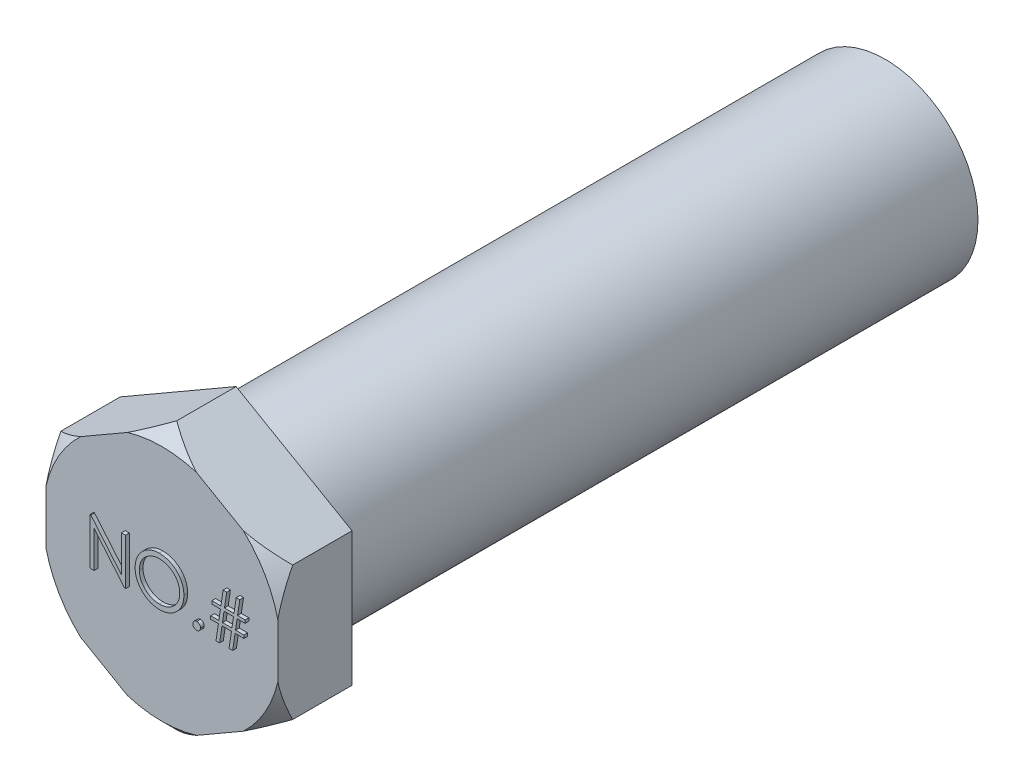
from build123d import *

# Parameters (mm, degrees)
SKETCH1_R           = 5
BOSS_EXTRUDE1_DEPTH = 35
BOSS_EXTRUDE2_DEPTH = 4
BOSS_EXTRUDE3_DEPTH = 0.2


with BuildPart() as part:
    # Sketch1 → Boss-Extrude1 (new body)
    with BuildSketch(Plane.XY):
        Circle(SKETCH1_R)
    extrude(amount=-BOSS_EXTRUDE1_DEPTH)

    # Sketch2 → Boss-Extrude2 (add)
    with BuildSketch(Plane.XY):
        Polygon((-6.25, -3.608439182), (0, -7.216878365), (6.25, -3.608439182), (6.25, 3.608439182), (0, 7.216878365), (-6.25, 3.608439182), align=None)
    extrude(amount=BOSS_EXTRUDE2_DEPTH)

    # Sketch3 → Cut-Revolve1 (revolve, cut)
    with BuildSketch(Plane(origin=(0, 0, 0), x_dir=(0, 0, -1), z_dir=(1, 0, 0))):
        Polygon((-3.2, 7.216878365), (-4, 7.216878365), (-4, 6.416878365), align=None)
    revolve(axis=Axis((0, 0, 0), (0, 0, 1)), mode=Mode.SUBTRACT)

    # Sketch4 → Boss-Extrude3 (add)
    # profile 1 of 4: a face of its own
    with BuildSketch(Plane.XY.offset(4)):
        Polygon((-3.679487179, -1), (-3.679487179, 1.5), (-3.632411859, 1.5), (-1.980769231, -0.467648237), (-1.980769231, 1.5), (-1.756410256, 1.5), (-1.756410256, -1), (-1.807491987, -1), (-3.455128205, 0.963141026), (-3.455128205, -1), align=None)
    # profile 2 of 4: a face of its own
    with BuildSketch(Plane.XY.offset(4)):
        with BuildLine():
            add(Edge.make_bspline(
                [(0.054487179, 1.564102564), (0.100778684, 1.562930079), (0.191699017, 1.560627221), (0.325323944, 1.54299929), (0.452891869, 1.512502583), (0.575441969, 1.471886167), (0.69150838, 1.417704463), (0.801964732, 1.352215071), (0.906548213, 1.274731886), (1.0038492, 1.185853867), (1.092889879, 1.0891514), (1.171336941, 0.985952893), (1.237081436, 0.87688232), (1.291071284, 0.762267441), (1.333427434, 0.642367464), (1.362655322, 0.516543176), (1.38132543, 0.385609826), (1.383508128, 0.296304923), (1.384615385, 0.251001603)],
                knots=[0, 0, 0, 0, 1.065120563, 2.091984664, 3.0946048, 4.079830382, 5.057816894, 6.036188127, 7.030412546, 8.04752943, 9.064399622, 10.05169764, 11.02544977, 11.989514704, 12.962713494, 13.945757189, 14.957906945, 16, 16, 16, 16], degree=3))
            add(Edge.make_bspline(
                [(1.384615385, 0.251001603), (1.38350829, 0.206031998), (1.381326078, 0.117391698), (1.362634094, -0.012710762), (1.333319094, -0.137775546), (1.291464618, -0.257593869), (1.237732134, -0.372292129), (1.171549869, -0.481568524), (1.093591861, -0.58545888), (1.004872682, -0.68282507), (0.908157652, -0.772108978), (0.804421747, -0.849908174), (0.695997947, -0.916853978), (0.581491012, -0.970270888), (0.462419558, -1.012965117), (0.337717898, -1.042074138), (0.20797036, -1.060850598), (0.119491071, -1.06300668), (0.074519231, -1.064102564)],
                knots=[0, 0, 0, 0, 1.043624062, 2.057103931, 3.04512605, 4.022047818, 4.998200453, 5.980619268, 6.982898556, 8.009068085, 9.034988726, 10.034168286, 11.015286542, 11.987931943, 12.962482838, 13.94673481, 14.956375938, 16, 16, 16, 16], degree=3))
            add(Edge.make_bspline(
                [(0.074519231, -1.064102564), (0.029216146, -1.062995859), (-0.060088294, -1.060814249), (-0.191186177, -1.042113246), (-0.317098851, -1.012869457), (-0.437466244, -0.971077003), (-0.55235548, -0.917064695), (-0.661991253, -0.851204425), (-0.765933501, -0.773056467), (-0.863320463, -0.684366056), (-0.952427033, -0.587814948), (-1.030112302, -0.484361908), (-1.095987382, -0.376036582), (-1.149818334, -0.262538351), (-1.192435805, -0.144415891), (-1.221510675, -0.020881265), (-1.24032207, 0.107361239), (-1.242489817, 0.194677595), (-1.243589744, 0.238982372)],
                knots=[0, 0, 0, 0, 1.053102029, 2.075944431, 3.073151272, 4.055350789, 5.033113405, 6.020478099, 7.024410459, 8.052272461, 9.079885166, 10.07527673, 11.055994387, 12.023226415, 12.992069828, 13.970394897, 14.97016774, 16, 16, 16, 16], degree=3))
            add(Edge.make_bspline(
                [(-1.243589744, 0.238982372), (-1.243207861, 0.268719993), (-1.242448914, 0.327820081), (-1.233311991, 0.415581938), (-1.220053633, 0.501932408), (-1.201052266, 0.586625942), (-1.176201076, 0.669455217), (-1.146878199, 0.750991476), (-1.111064024, 0.830408422), (-1.070577847, 0.908082273), (-1.025390841, 0.982802206), (-0.975479591, 1.053430479), (-0.922597185, 1.120559763), (-0.864623333, 1.18245048), (-0.803468729, 1.240903091), (-0.738141316, 1.295019318), (-0.669039713, 1.34528714), (-0.595866584, 1.390587384), (-0.520424959, 1.431558194), (-0.442655832, 1.466716659), (-0.363615424, 1.496892417), (-0.282933533, 1.52135015), (-0.20082441, 1.540658747), (-0.11710885, 1.553806856), (-0.031853545, 1.562967084), (0.025583111, 1.563722442), (0.054487179, 1.564102564)],
                knots=[0, 0, 0, 0, 1.037015668, 2.060948919, 3.074880161, 4.083647147, 5.086022904, 6.090072063, 7.104153813, 8.122640571, 9.144368836, 10.147691507, 11.138137339, 12.123020368, 13.103399296, 14.087645067, 15.080126199, 16.082011238, 17.087798457, 18.072939717, 19.057185487, 20.037253025, 21.01195951, 21.997135196, 22.992090687, 24, 24, 24, 24], degree=3))
        make_face()
        with BuildLine():
            add(Edge.make_bspline(
                [(0.065504808, 1.307692308), (0.041780069, 1.3074031), (-0.005442597, 1.306827451), (-0.075645837, 1.299244797), (-0.14492579, 1.288437733), (-0.213296763, 1.273022361), (-0.280472684, 1.252019466), (-0.347079713, 1.227847389), (-0.412510466, 1.198403753), (-0.476548936, 1.165137535), (-0.538631132, 1.128316878), (-0.597211633, 1.087622758), (-0.652442093, 1.044009505), (-0.704187284, 0.997375336), (-0.752295264, 0.947482763), (-0.797712908, 0.895088166), (-0.838619752, 0.838693958), (-0.87610945, 0.779829382), (-0.909657907, 0.718571109), (-0.939490303, 0.655564065), (-0.963893167, 0.590294289), (-0.983794864, 0.52346989), (-1.000294729, 0.455196705), (-1.010747532, 0.384956813), (-1.018413503, 0.313103161), (-1.01895625, 0.264544694), (-1.019230769, 0.239983974)],
                knots=[0, 0, 0, 0, 1.008559885, 2.007477868, 2.99961109, 3.989939068, 4.984837346, 5.991145699, 7.001802488, 8.033829008, 9.059044045, 10.069351652, 11.065060232, 12.050310815, 13.029377138, 14.011219647, 14.996725999, 15.989392538, 16.977580475, 17.965360261, 18.951710183, 19.937753436, 20.929683414, 21.935841486, 22.955955122, 24, 24, 24, 24], degree=3))
            add(Edge.make_bspline(
                [(-1.019230769, 0.239983974), (-1.018320154, 0.203868102), (-1.016528691, 0.132817009), (-1.000844712, 0.028696907), (-0.976686159, -0.071366155), (-0.941073754, -0.166824662), (-0.896537601, -0.25849915), (-0.841518394, -0.345576367), (-0.776333333, -0.428079849), (-0.702287956, -0.505433612), (-0.621343166, -0.576037758), (-0.535391216, -0.638011622), (-0.445352925, -0.690447514), (-0.350993494, -0.733165423), (-0.252816681, -0.767015236), (-0.150189859, -0.790214258), (-0.043796673, -0.805482441), (0.028725223, -0.806948695), (0.065504808, -0.807692308)],
                knots=[0, 0, 0, 0, 1.032063989, 2.030389145, 3.003944642, 3.970395727, 4.937377036, 5.913328081, 6.909231446, 7.93887556, 8.970685674, 9.976071282, 10.964166581, 11.944589148, 12.933237628, 13.927779006, 14.949070134, 16, 16, 16, 16], degree=3))
            add(Edge.make_bspline(
                [(0.065504808, -0.807692308), (0.09022588, -0.807352662), (0.139255192, -0.806679042), (0.212180565, -0.799894273), (0.283792145, -0.789014366), (0.353989488, -0.773349612), (0.422692924, -0.753744464), (0.490189212, -0.73045323), (0.55575942, -0.701395227), (0.620230732, -0.669289548), (0.681942334, -0.632689435), (0.740853428, -0.593376471), (0.795479128, -0.549827456), (0.847185608, -0.503886162), (0.8954911, -0.45462627), (0.940068946, -0.402111826), (0.98076904, -0.346011357), (1.018244502, -0.287236067), (1.051675404, -0.225810172), (1.080803332, -0.162574688), (1.105514843, -0.097685324), (1.125463775, -0.031048487), (1.141096248, 0.037209262), (1.151867619, 0.107179318), (1.159402218, 0.178721705), (1.15997013, 0.227110174), (1.16025641, 0.251502404)],
                knots=[0, 0, 0, 0, 1.047197238, 2.076906641, 3.100256066, 4.114471768, 5.12198147, 6.126382909, 7.136867548, 8.15857795, 9.17633901, 10.174870724, 11.156907918, 12.133735059, 13.104061851, 14.077631395, 15.04955518, 16.038496417, 17.029181396, 18.010275684, 18.986308667, 19.968651475, 20.955262928, 21.950658345, 22.966943676, 24, 24, 24, 24], degree=3))
            add(Edge.make_bspline(
                [(1.16025641, 0.251502404), (1.159969901, 0.275727764), (1.159401557, 0.323783228), (1.151871218, 0.39482667), (1.141084868, 0.46429325), (1.125540076, 0.531910252), (1.105504252, 0.597694913), (1.080799016, 0.661585447), (1.051666659, 0.723819872), (1.018232213, 0.78424437), (0.980649482, 0.842226325), (0.939582166, 0.89765662), (0.894321203, 0.949494292), (0.846159756, 0.999019074), (0.793894838, 1.045174709), (0.7377632, 1.08797651), (0.678446287, 1.12845742), (0.615641119, 1.164975678), (0.550824009, 1.19870013), (0.484314039, 1.227593704), (0.416864682, 1.252145218), (0.348647459, 1.273085907), (0.279088189, 1.288377357), (0.208656883, 1.299254536), (0.137450984, 1.306824811), (0.08956297, 1.307402225), (0.065504808, 1.307692308)],
                knots=[0, 0, 0, 0, 1.02996197, 2.043119294, 3.035359645, 4.018872909, 4.991431989, 5.957985074, 6.929999688, 7.912076566, 8.892894881, 9.867085534, 10.843653904, 11.817741046, 12.803660682, 13.806313499, 14.818574707, 15.856120519, 16.894564902, 17.924820532, 18.937903209, 19.946497019, 20.957711757, 21.963978472, 22.977135795, 24, 24, 24, 24], degree=3))
        make_face(mode=Mode.SUBTRACT)
    # profile 3 of 4: a face of its own
    with BuildSketch(Plane.XY.offset(4)):
        with BuildLine():
            add(Edge.make_bspline(
                [(2.073717949, -0.615384615), (2.087639529, -0.616211877), (2.114931159, -0.617833628), (2.154387679, -0.628959823), (2.190098151, -0.648716009), (2.221906897, -0.675046565), (2.248125809, -0.706972039), (2.26858606, -0.742397688), (2.279615335, -0.78218454), (2.281225272, -0.809634308), (2.282051282, -0.823717949)],
                knots=[0, 0, 0, 0, 1.020151414, 1.999887582, 2.974338812, 3.990962822, 5.007586832, 5.987933904, 6.967670073, 8, 8, 8, 8], degree=3))
            add(Edge.make_bspline(
                [(2.282051282, -0.823717949), (2.281197282, -0.837463184), (2.279513205, -0.864568587), (2.268611342, -0.904055346), (2.247969878, -0.939503135), (2.22208774, -0.971861805), (2.190090287, -0.998248141), (2.154303254, -1.017836244), (2.115023784, -1.029759087), (2.087654982, -1.031277871), (2.073717949, -1.032051282)],
                knots=[0, 0, 0, 0, 1.009421747, 1.99056486, 2.972319754, 3.999869655, 5.017953583, 5.993804169, 6.978383603, 8, 8, 8, 8], degree=3))
            add(Edge.make_bspline(
                [(2.073717949, -1.032051282), (2.059770873, -1.031305855), (2.032542529, -1.029850588), (1.993409676, -1.01759144), (1.957404698, -0.998431826), (1.925413475, -0.971812605), (1.899314567, -0.939669645), (1.879582151, -0.903811219), (1.867732044, -0.864681621), (1.866173564, -0.837485448), (1.865384615, -0.823717949)],
                knots=[0, 0, 0, 0, 1.022052826, 1.995314843, 2.982371812, 4.00089066, 5.028879526, 6.005146991, 6.990147033, 8, 8, 8, 8], degree=3))
            add(Edge.make_bspline(
                [(1.865384615, -0.823717949), (1.866143258, -0.809611249), (1.867624414, -0.782069649), (1.879607028, -0.742641715), (1.899161465, -0.706807116), (1.92559389, -0.675095273), (1.957396959, -0.648532914), (1.99332282, -0.629200919), (2.032636777, -0.617743481), (2.059786733, -0.616184541), (2.073717949, -0.615384615)],
                knots=[0, 0, 0, 0, 1.032775665, 2.016367738, 2.991239715, 4.008302682, 5.025365648, 6.011011707, 6.979408107, 8, 8, 8, 8], degree=3))
        make_face()
    # profile 4 of 4: a face of its own
    with BuildSketch(Plane.XY.offset(4)):
        Polygon((4.621794872, 0.025641026), (4.621794872, -0.134615385), (4.144030449, -0.134615385), (4.014322917, -1), (3.820512821, -1), (3.950220353, -0.134615385), (3.438902244, -0.134615385), (3.309194712, -1), (3.115384615, -1), (3.245092147, -0.134615385), (2.826923077, -0.134615385), (2.826923077, 0.025641026), (3.269130609, 0.025641026), (3.355769231, 0.602564103), (2.891025641, 0.602564103), (2.891025641, 0.762820513), (3.379807692, 0.762820513), (3.5, 1.564102564), (3.693309295, 1.564102564), (3.573116987, 0.762820513), (4.084935897, 0.762820513), (4.205128205, 1.564102564), (4.3984375, 1.564102564), (4.278245192, 0.762820513), (4.685897436, 0.762820513), (4.685897436, 0.602564103), (4.254206731, 0.602564103), (4.16806891, 0.025641026), align=None)
        Polygon((4.060897436, 0.602564103), (3.549078526, 0.602564103), (3.462940705, 0.025641026), (3.974258814, 0.025641026), align=None, mode=Mode.SUBTRACT)
    extrude(amount=BOSS_EXTRUDE3_DEPTH)


solid = part.part
